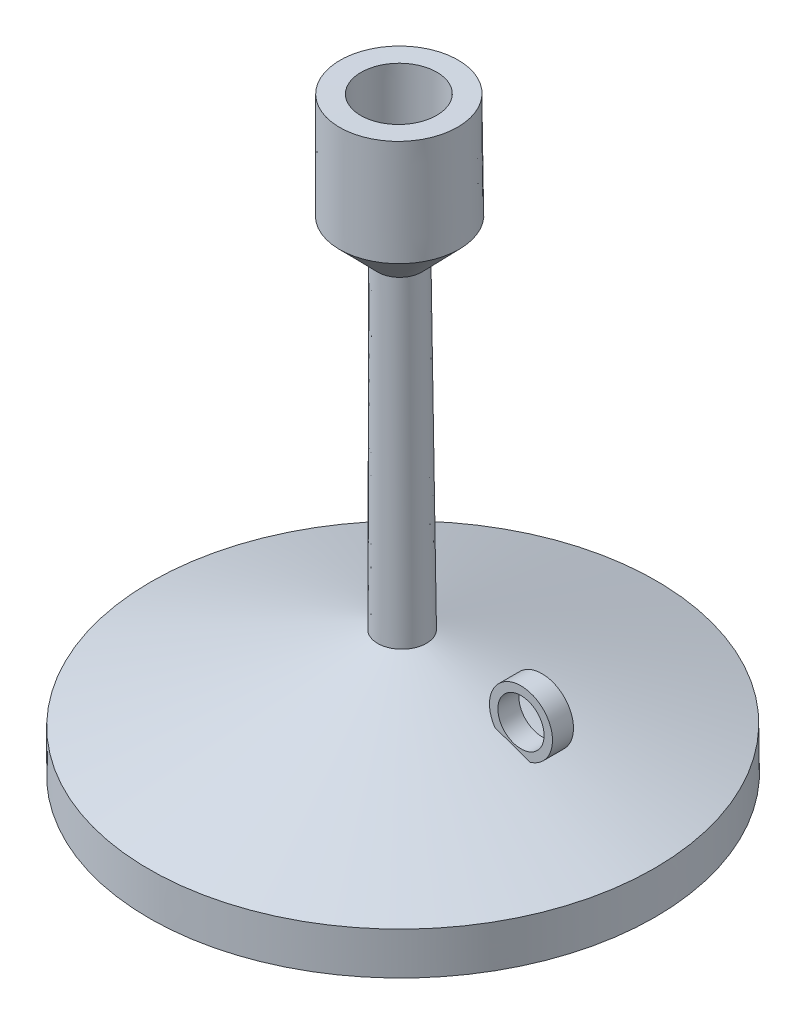
from build123d import *

# Parameters (mm, degrees)
SKETCH2_R           = 7.5
SKETCH2_R_2         = 5.5
BOSS_EXTRUDE1_DEPTH = 2.5


with BuildPart() as part:
    # Sketch1 → Revolve1 (revolve)
    with BuildSketch(Plane.XY, mode=Mode.PRIVATE) as revolve1_sk:
        Polygon((-0.855365474, 120), (-10, 120), (-10, 140), (-15, 140), (-15, 115), (-6, 106), (-6, 30), (-60, 10), (-60, 0), (0, 0), align=None)
    revolve(revolve1_sk.sketch.rotate(Axis((-0.855365474, 120, 0), (0.0071278645418364215, -0.9999745964508665, 0)), 180), axis=Axis((-0.855365474, 120, 0), (0.0071278645418364215, -0.9999745964508665, 0)))

    # Sketch2 → Boss-Extrude1 (add, symmetric)
    with BuildSketch(Plane.XY):
        with Locations((30.571729314, 27.591749237)):
            Circle(SKETCH2_R)
        with Locations((30.571729314, 27.591749237)):
            Circle(SKETCH2_R_2, mode=Mode.SUBTRACT)
    extrude(amount=BOSS_EXTRUDE1_DEPTH, both=True)


solid = part.part
